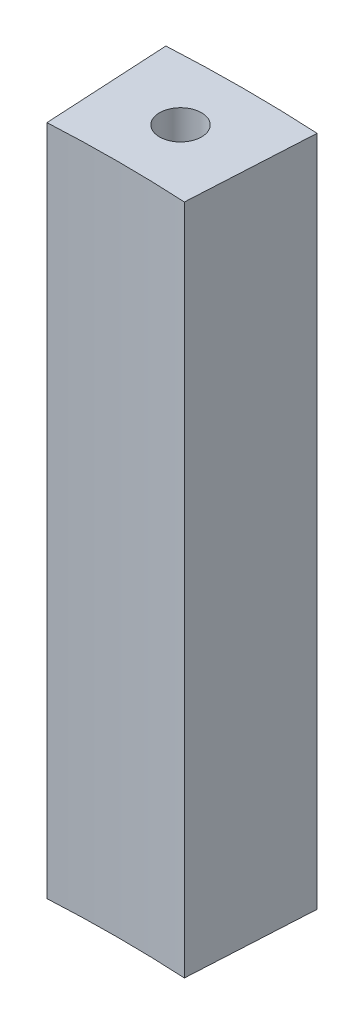
from build123d import *

# Parameters (mm, degrees)
SKETCH_1_R      = 2.5
EXTRUDE_1_DEPTH = 80


with BuildPart() as part:
    # 草图1 → 凸台-拉伸1 (new body)
    with BuildSketch(Plane(origin=(0, 0, 0), x_dir=(1, 0, 0), z_dir=(0, 1, 0))):
        with BuildLine():
            Line((-8.181818182, 149.776693285), (-9, 164.754362613))
            ThreePointArc((-9, 164.754362613), (0, 165), (9, 164.754362613))
            Line((9, 164.754362613), (8.181818182, 149.776693285))
            ThreePointArc((8.181818182, 149.776693285), (0, 150), (-8.181818182, 149.776693285))
        make_face()
        with Locations(Location((0, 157.5, 0), (0, 0, 270))):
            Circle(SKETCH_1_R, mode=Mode.SUBTRACT)
    extrude(amount=EXTRUDE_1_DEPTH)


solid = part.part
